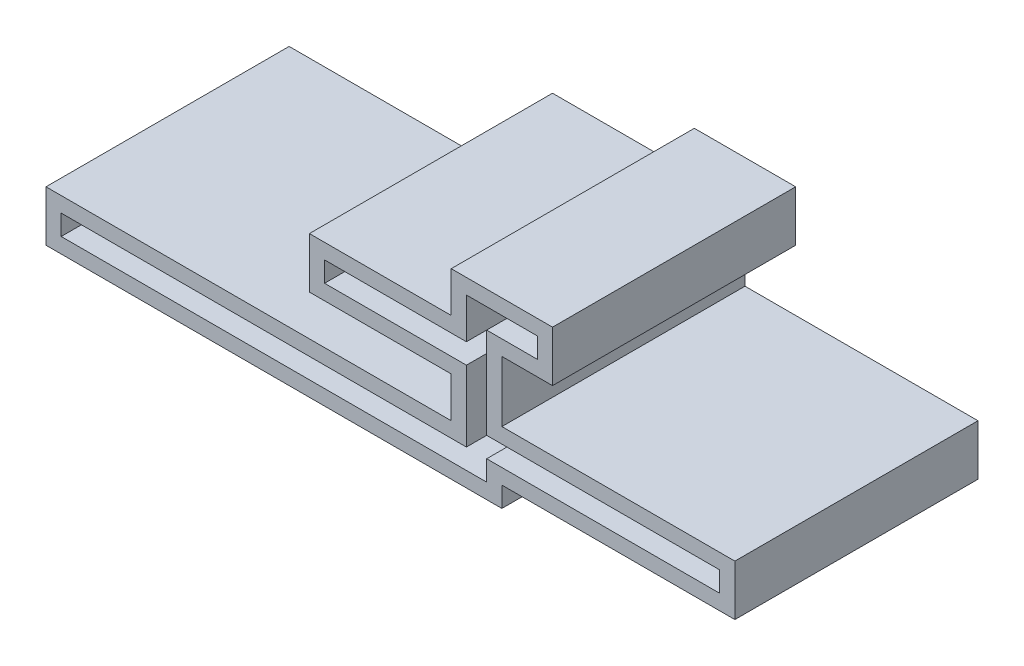
from build123d import *

# Parameters (mm, degrees)
BOSS_EXTRUDE1_DEPTH = 304.8
SHELL1_T            = -19.05


with BuildPart() as part:
    # Sketch1 → Boss-Extrude1 (new body)
    with BuildSketch(Plane.XY):
        Polygon((-241.3, 177.8), (-63.5, 177.8), (-63.5, 228.6), (63.5, 228.6), (63.5, 165.1), (0, 165.1), (0, 88.9), (292.1, 88.9), (292.1, 25.4), (0, 25.4), (0, 0), (-571.5, 0), (-571.5, 63.5), (-63.5, 63.5), (-63.5, 114.3), (-241.3, 114.3), align=None)
    extrude(amount=BOSS_EXTRUDE1_DEPTH)

    # Shell1
    shell1_openings = [part.faces().sort_by_distance(p)[0] for p in [
        (-152.4, 168.866563259, 304.8),
    ]]
    offset(amount=SHELL1_T, openings=shell1_openings, kind=Kind.INTERSECTION)


solid = part.part
